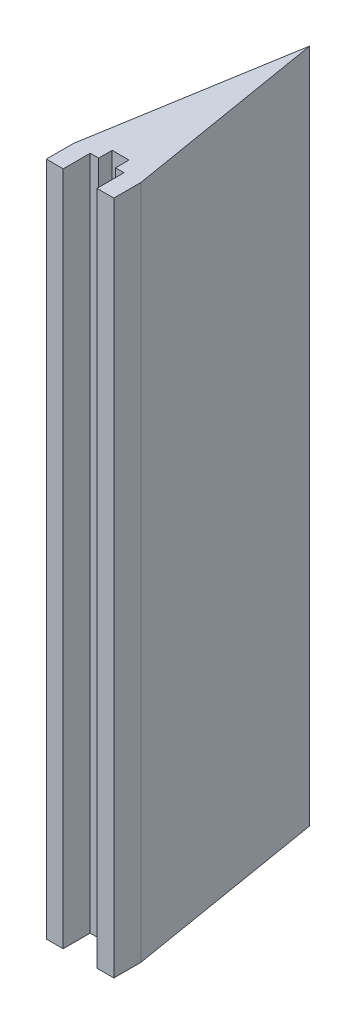
from build123d import *

# Parameters (mm, degrees)
BOSS_EXTRUDE1_DEPTH = 127


with BuildPart() as part:
    # Sketch1 → Boss-Extrude1 (new body)
    with BuildSketch(Plane(origin=(0, 0, 0), x_dir=(1, 0, 0), z_dir=(0, 1, 0))):
        Polygon((0, 38.1), (-6.35, 0), (-6.35, -5.08), (-3.175, -5.08), (-3.175, 0), (-1.5875, 0), (-1.5875, 2.54), (1.5875, 2.54), (1.5875, 0), (3.175, 0), (3.175, -5.08), (6.35, -5.08), (6.35, 0), align=None)
    extrude(amount=BOSS_EXTRUDE1_DEPTH)


solid = part.part
